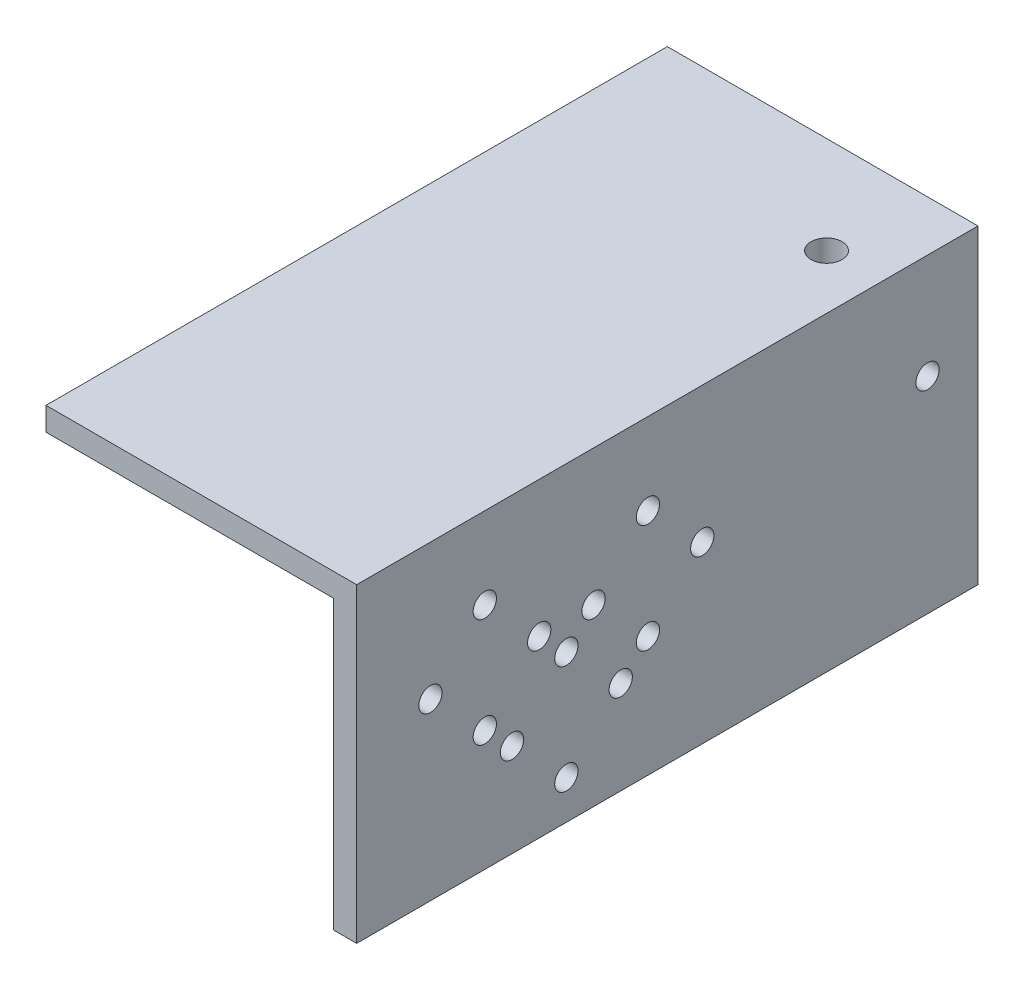
from build123d import *

# Parameters (mm, degrees)
SKETCH_1_W          = 40
SKETCH_1_H          = 40
EXTRUDE_1_DEPTH     = 80
SHELL_1_T           = -3
SKETCH_2_R          = 1.5
CUT_EXTRUDE_1_DEPTH = 98.979589711
SKETCH_3_R          = 2
CUT_EXTRUDE_2_DEPTH = 80


with BuildPart() as part:
    # 草图1 → 凸台-拉伸1 (new body)
    with BuildSketch(Plane.XY):
        with Locations((20, -20)):
            Rectangle(SKETCH_1_W, SKETCH_1_H)
    extrude(amount=-EXTRUDE_1_DEPTH)

    # 抽壳1
    shell_1_openings = [part.faces().sort_by_distance(p)[0] for p in [
        (20, -20, -80),
        (20, -20, 0),
        (20, -40, -40),
        (0, -20, -40),
    ]]
    offset(amount=SHELL_1_T, openings=shell_1_openings, kind=Kind.INTERSECTION)

    # 草图2 → 切除-拉伸1 (cut, through all)
    with BuildSketch(Plane(origin=(40, 0, 0), x_dir=(0, 0, -1), z_dir=(1, 0, 0))):
        with Locations(Location((44.5, -17.5, 0), (0, 0, 90))):
            Circle(SKETCH_2_R)
        with Locations(Location((27, -21, 0), (0, 0, 90))):
            Circle(SKETCH_2_R)
        with Locations(Location((34, -28, 0), (0, 0, 90))):
            Circle(SKETCH_2_R)
        with Locations(Location((27, -35, 0), (0, 0, 90))):
            Circle(SKETCH_2_R)
        with Locations(Location((20, -28, 0), (0, 0, 90))):
            Circle(SKETCH_2_R)
        with Locations(Location((73.5, -13.5, 0), (0, 0, 90))):
            Circle(SKETCH_2_R)
        with Locations(Location((16.5, -10.5, 0), (0, 0, 90))):
            Circle(SKETCH_2_R)
        with Locations(Location((23.5, -17.5, 0), (0, 0, 90))):
            Circle(SKETCH_2_R)
        with Locations(Location((9.5, -17.5, 0), (0, 0, 90))):
            Circle(SKETCH_2_R)
        with Locations(Location((16.5, -24.5, 0), (0, 0, 90))):
            Circle(SKETCH_2_R)
        with Locations(Location((37.5, -24.5, 0), (0, 0, 90))):
            Circle(SKETCH_2_R)
        with Locations(Location((30.5, -17.5, 0), (0, 0, 90))):
            Circle(SKETCH_2_R)
        with Locations(Location((37.5, -10.5, 0), (0, 0, 90))):
            Circle(SKETCH_2_R)
    extrude(amount=-CUT_EXTRUDE_1_DEPTH, mode=Mode.SUBTRACT)

    # 草图3 → 切除-拉伸2 (cut)
    with BuildSketch(Plane(origin=(0, 0, 0), x_dir=(1, 0, 0), z_dir=(0, 1, 0))):
        with Locations(Location((33, 67.5, 0), (0, 0, 270))):
            Circle(SKETCH_3_R)
    extrude(amount=-CUT_EXTRUDE_2_DEPTH, mode=Mode.SUBTRACT)


solid = part.part
